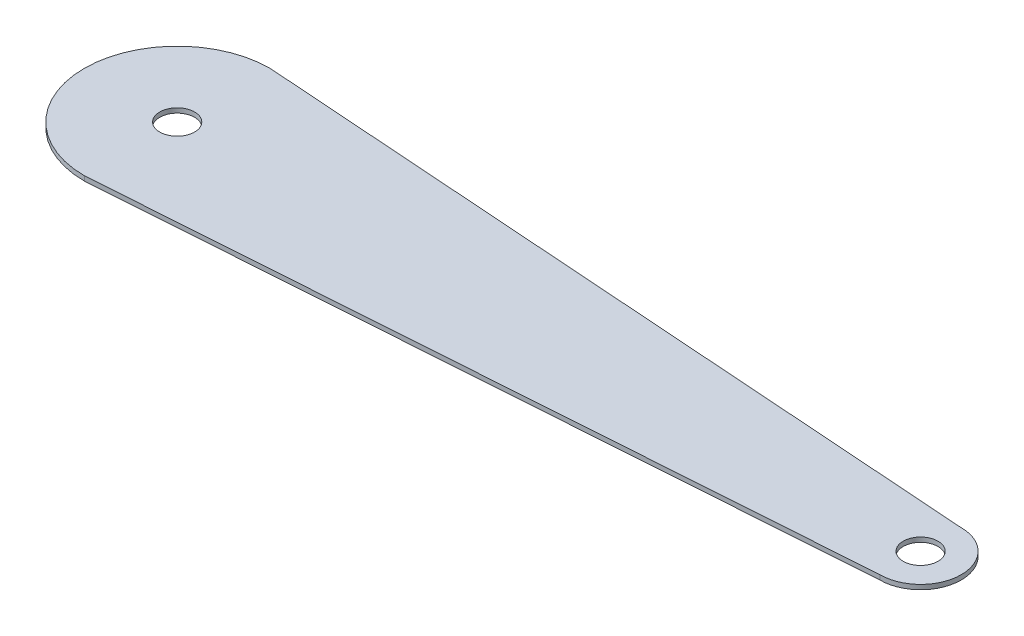
from build123d import *

# Parameters (mm, degrees)
BOSS_EXTRUDE1_DEPTH = 2.54
SKETCH4_R           = 9.525
CUT_EXTRUDE1_DEPTH  = 175.768


with BuildPart() as part:
    # Sketch3 → Boss-Extrude1 (new body)
    with BuildSketch(Plane(origin=(0, 0, 0), x_dir=(1, 0, 0), z_dir=(0, 1, 0))):
        with BuildLine():
            Line((-203.2, 50.8), (203.2, 22.225))
            ThreePointArc((203.2, 22.225), (225.425, 0), (203.2, -22.225))
            Line((203.2, -22.225), (-203.2, -50.8))
            ThreePointArc((-203.2, -50.8), (-254, 0), (-203.2, 50.8))
        make_face()
    extrude(amount=BOSS_EXTRUDE1_DEPTH)

    # Sketch4 → Cut-Extrude1 (cut)
    with BuildSketch(Plane(origin=(0, 2.54, 0), x_dir=(1, 0, 0), z_dir=(0, 1, 0))):
        with Locations(Location((-203.2, 0, 0), (0, 0, 270))):
            Circle(SKETCH4_R)
        with Locations(Location((203.2, 0, 0), (0, 0, 270))):
            Circle(SKETCH4_R)
    extrude(amount=-CUT_EXTRUDE1_DEPTH, mode=Mode.SUBTRACT)


solid = part.part
